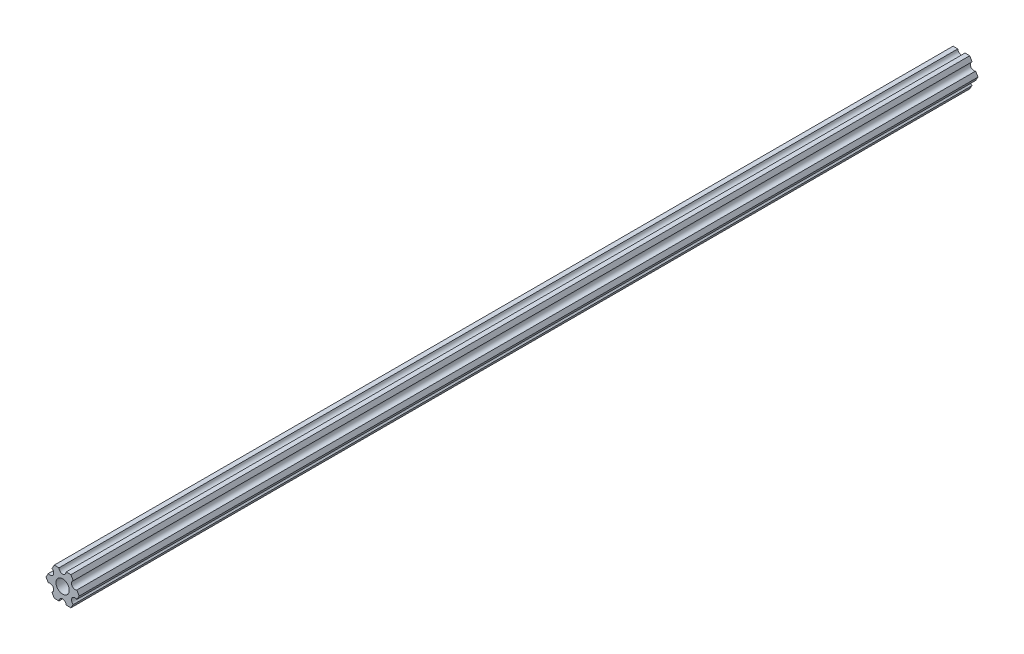
from build123d import *

# Parameters (mm, degrees)
SKETCH1_R           = 2.9337
BOSS_EXTRUDE1_DEPTH = 396.875


with BuildPart() as part:
    # Sketch1 → Boss-Extrude1 (new body)
    with BuildSketch(Plane.XY.offset(304.8)):
        with BuildLine():
            Line((6.293011699, -1.800184894), (7.332348803, -2.22e-07))
            Line((7.332348803, -2.22e-07), (6.293011439, 1.800184522))
            ThreePointArc((6.293011439, 1.800184522), (4.124446058, 2.381249653), (4.705511189, 4.549815034))
            Line((4.705511189, 4.549815034), (3.666173825, 6.349999778))
            Line((3.666173825, 6.349999778), (1.587499615, 6.349999778))
            ThreePointArc((1.587499615, 6.349999778), (-3.85e-07, 4.762499778), (-1.587500385, 6.349999778))
            Line((-1.587500385, 6.349999778), (-3.666174594, 6.349999778))
            Line((-3.666174594, 6.349999778), (-4.70551159, 4.549815043))
            ThreePointArc((-4.70551159, 4.549815043), (-4.12444613, 2.38124975), (-6.293011423, 1.80018429))
            Line((-6.293011423, 1.80018429), (-7.332348419, -4.44e-07))
            Line((-7.332348419, -4.44e-07), (-6.293011205, -1.800185053))
            ThreePointArc((-6.293011205, -1.800185053), (-4.124445841, -2.38125025), (-4.705511038, -4.549815614))
            Line((-4.705511038, -4.549815614), (-3.666173825, -6.350000222))
            Line((-3.666173825, -6.350000222), (-1.587499615, -6.350000222))
            ThreePointArc((-1.587499615, -6.350000222), (3.85e-07, -4.762500222), (1.587500385, -6.350000222))
            Line((1.587500385, -6.350000222), (3.666174594, -6.350000222))
            Line((3.666174594, -6.350000222), (4.705511699, -4.549815551))
            ThreePointArc((4.705511699, -4.549815551), (4.12444637, -2.381250222), (6.293011699, -1.800184894))
        make_face()
        Circle(SKETCH1_R, mode=Mode.SUBTRACT)
    extrude(amount=-BOSS_EXTRUDE1_DEPTH)


solid = part.part
